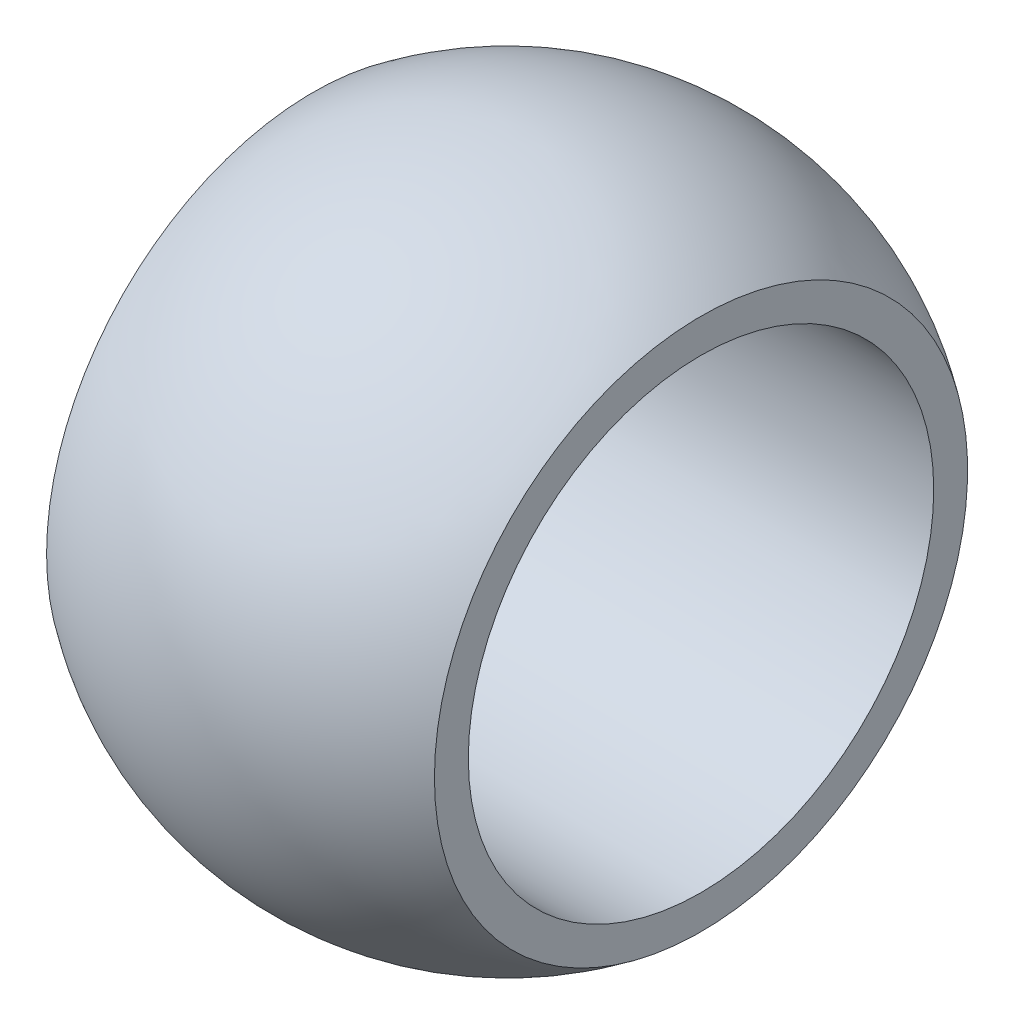
from build123d import *


with BuildPart() as part:
    # Esquisse1 → Base-Révolution (revolve)
    with BuildSketch(Plane.XY, mode=Mode.PRIVATE) as base_r_volution_sk:
        with BuildLine():
            Line((5, 6.873863542), (5, 6))
            Line((5, 6), (-5, 6))
            Line((-5, 6), (-5, 6.873863542))
            ThreePointArc((-5, 6.873863542), (0, 8.5), (5, 6.873863542))
        make_face()
    revolve(base_r_volution_sk.sketch.rotate(Axis((-70, 0, 0), (1, 0, 0)), 90), axis=Axis((-70, 0, 0), (1, 0, 0)))


solid = part.part
